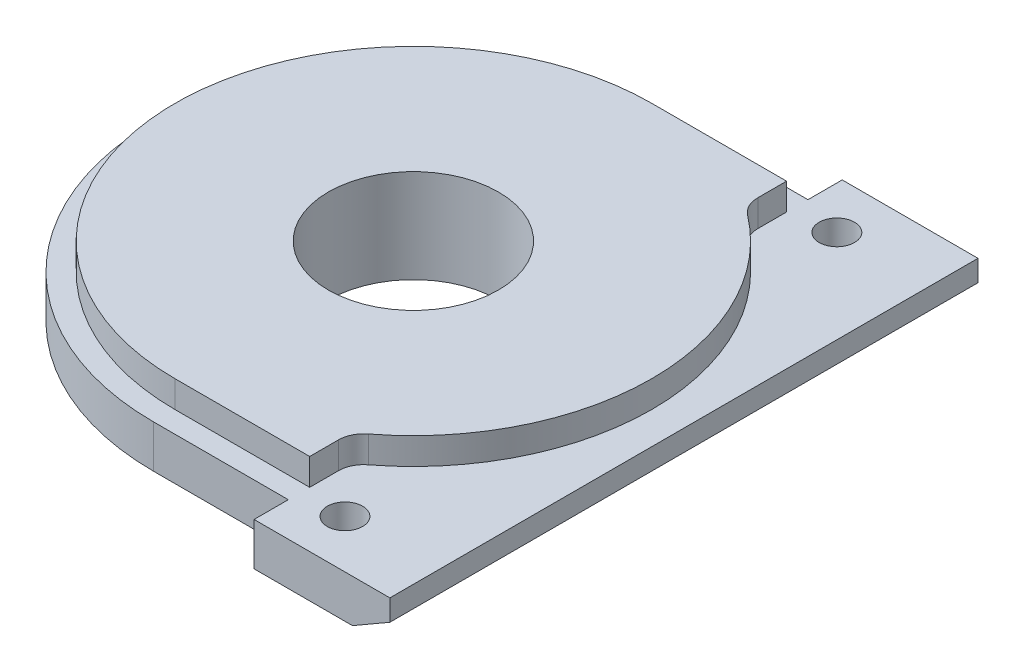
from build123d import *
from build123d.topology import SkipClean

# Parameters (mm, degrees)
BOSS_EXTRUDE1_DEPTH = 4
BOSS_EXTRUDE2_DEPTH = 2.5
SKETCH3_R           = 7.95
CUT_EXTRUDE1_DEPTH  = 9.25
SKETCH4_R           = 1.65
CUT_EXTRUDE2_DEPTH  = 9.25
CUT_EXTRUDE3_DEPTH  = 3.25
FILLET1_R           = 2.38125
CHAMFER1_SIZE       = 3.5
CHAMFER1_SIZE2      = 2.020725942
BOSS_EXTRUDE4_DEPTH = 4
BOSS_EXTRUDE5_START = 2.25
SKETCH11_R          = 11.95
BOSS_EXTRUDE5_DEPTH = 2.25
CUT_EXTRUDE4_START  = -2.25
SKETCH12_R          = 7.95
CUT_EXTRUDE4_DEPTH  = 2.25
FILLET5_R           = 2.38


with BuildPart() as part:
    # Sketch1 → Boss-Extrude1 (new body)
    with BuildSketch(Plane(origin=(0, 0, 0), x_dir=(1, 0, 0), z_dir=(0, 1, 0))):
        with BuildLine():
            Line((-13.29118379, 20.889836125), (-0.68999579, 20.889836125))
            Line((-0.68999579, 20.889836125), (-0.68999579, 26.09210312))
            Line((-0.68999579, 26.09210312), (12.01000421, 26.09210312))
            Line((12.01000421, 26.09210312), (12.01000421, -28.90789688))
            Line((12.01000421, -28.90789688), (-0.68999579, -28.90789688))
            Line((-0.68999579, -28.90789688), (-0.68999579, -23.705629885))
            Line((-0.68999579, -23.705629885), (-13.29118379, -23.705629885))
            ThreePointArc((-13.29118379, -23.705629885), (-35.588916795, -1.40789688), (-13.29118379, 20.889836125))
        make_face()
    extrude(amount=BOSS_EXTRUDE1_DEPTH)

    # Sketch2 → Boss-Extrude2 (add)
    with BuildSketch(Plane(origin=(0, 4, 0), x_dir=(1, 0, 0), z_dir=(0, 1, 0))):
        with BuildLine():
            Line((-13.29118379, 20.889836125), (-0.68999579, 20.889836125))
            Line((-0.68999579, 20.889836125), (-0.68999579, 16.987726462))
            ThreePointArc((-0.68999579, 16.987726462), (9.006549215, -1.40789688), (-0.68999579, -19.803520222))
            Line((-0.68999579, -19.803520222), (-0.68999579, -23.705629885))
            Line((-0.68999579, -23.705629885), (-13.29118379, -23.705629885))
            ThreePointArc((-13.29118379, -23.705629885), (-35.588916795, -1.40789688), (-13.29118379, 20.889836125))
        make_face()
    extrude(amount=BOSS_EXTRUDE2_DEPTH)

    # Sketch3 → Cut-Extrude1 (cut)
    with BuildSketch(Plane.XZ):
        with Locations(Location((-13.29118379, 1.40789688, 0), (0, 0, 270))):
            Circle(SKETCH3_R)
    extrude(amount=-CUT_EXTRUDE1_DEPTH, mode=Mode.SUBTRACT)

    # Sketch4 → Cut-Extrude2 (cut)
    with BuildSketch(Plane.XZ):
        with Locations(Location((3.31000421, 24.40789688, 0), (0, 0, 270))):
            Circle(SKETCH4_R)
        with Locations(Location((3.310004206, -21.59210312, 0), (0, 0, 270))):
            Circle(SKETCH4_R)
    extrude(amount=-CUT_EXTRUDE2_DEPTH, mode=Mode.SUBTRACT)

    # Sketch5 → Cut-Extrude3 (cut)
    with BuildSketch(Plane.XZ):
        with BuildLine():
            ThreePointArc((-20.917233099, -7.792422241), (-25.24118379, 1.40789688), (-20.917233099, 10.608216001))
            Line((-20.917233099, 10.608216001), (-24.193916765, 16.291878661))
            ThreePointArc((-24.193916765, 16.291878661), (-31.74118379, 1.40789688), (-24.193916765, -13.476084902))
            Line((-24.193916765, -13.476084902), (-20.917233099, -7.792422241))
        make_face()
        with BuildLine():
            Line((-20.729723635, 18.291931497), (-17.445869217, 12.612408873))
            ThreePointArc((-17.445869217, 12.612408873), (-7.31618379, 11.756900455), (-1.510449053, 3.412089752))
            Line((-1.510449053, 3.412089752), (5.05008903, 3.407949716))
            ThreePointArc((5.05008903, 3.407949716), (-4.06618379, 17.38606558), (-20.729723635, 18.291931497))
        make_face()
        with BuildLine():
            ThreePointArc((-1.510449053, -0.596295992), (-7.31618379, -8.941106696), (-17.445869217, -9.796615113))
            Line((-17.445869217, -9.796615113), (-20.729723635, -15.476137738))
            ThreePointArc((-20.729723635, -15.476137738), (-4.06618379, -14.57027182), (5.05008903, -0.592155956))
            Line((5.05008903, -0.592155956), (-1.510449053, -0.596295992))
        make_face()
    extrude(amount=-CUT_EXTRUDE3_DEPTH, mode=Mode.SUBTRACT)

    # Fillet1
    fillet1_edges = [part.edges().sort_by_distance(p)[0] for p in [
        (-20.917233099, 1.625, 10.608216001),
        (-20.917233099, 1.625, -7.792422241),
        (-24.193916765, 1.625, -13.476084902),
        (-24.193916765, 1.625, 16.291878661),
        (5.05008903, 1.625, 3.407949716),
        (-1.510449053, 1.625, 3.412089752),
        (-17.445869217, 1.625, 12.612408873),
        (-20.729723635, 1.625, 18.291931497),
        (-17.445869217, 1.625, -9.796615113),
        (-1.510449053, 1.625, -0.596295992),
        (5.05008903, 1.625, -0.592155956),
        (-20.729723635, 1.625, -15.476137738),
    ]]
    fillet(fillet1_edges, radius=FILLET1_R)

    # Chamfer1
    chamfer1_edges = [part.edges().sort_by_distance(p)[0] for p in [
        (12.01000421, 0, 1.40789688),
    ]]
    chamfer1_side = [part.faces().sort_by_distance(p)[0] for p in [
        (-3.702499267, 0, 18.015985651),
    ]]
    chamfer(chamfer1_edges, length=CHAMFER1_SIZE, length2=CHAMFER1_SIZE2, reference=chamfer1_side[0])

    # Sketch10 → Boss-Extrude4 (add)
    with BuildSketch(Plane.XZ):
        with BuildLine():
            Line((-0.68999579, -22.889836125), (-13.29118379, -22.889836125))
            ThreePointArc((-13.29118379, -22.889836125), (-37.588916795, 1.40789688), (-13.29118379, 25.705629885))
            Line((-13.29118379, 25.705629885), (-0.68999579, 25.705629885))
            Line((-0.68999579, 25.705629885), (-0.68999579, 23.705629885))
            Line((-0.68999579, 23.705629885), (-13.29118379, 23.705629885))
            ThreePointArc((-13.29118379, 23.705629885), (-35.588916795, 1.40789688), (-13.29118379, -20.889836125))
            Line((-13.29118379, -20.889836125), (-0.68999579, -20.889836125))
            Line((-0.68999579, -20.889836125), (-0.68999579, -22.889836125))
        make_face()
    extrude(amount=-BOSS_EXTRUDE4_DEPTH)

    # Sketch11 → Boss-Extrude5 (add)
    with SkipClean():  # the faces are left unmerged after this step: merging them gives an invalid solid
        with BuildSketch(Plane.XZ.offset(BOSS_EXTRUDE5_START)):
            with Locations(Location((-13.29118379, 1.40789688, 0), (0, 0, 270))):
                Circle(SKETCH11_R)
        extrude(amount=-BOSS_EXTRUDE5_DEPTH)

    # Sketch12 → Cut-Extrude4 (cut)
    with SkipClean():  # the faces are left unmerged after this step: merging them gives an invalid solid
        with BuildSketch(Plane(origin=(0, 0, 0), x_dir=(1, 0, 0), z_dir=(0, 1, 0)).offset(CUT_EXTRUDE4_START)):
            with Locations(Location((-13.29118379, -1.40789688, 0), (0, 0, 270))):
                Circle(SKETCH12_R)
        extrude(amount=CUT_EXTRUDE4_DEPTH, mode=Mode.SUBTRACT)

    # Fillet5
    fillet5_edges = [part.edges().sort_by_distance(p)[0] for p in [
        (-0.68999579, 5.25, 19.803520222),
        (-0.68999579, 5.25, -16.987726462),
    ]]
    fillet(fillet5_edges, radius=FILLET5_R)


solid = part.part
